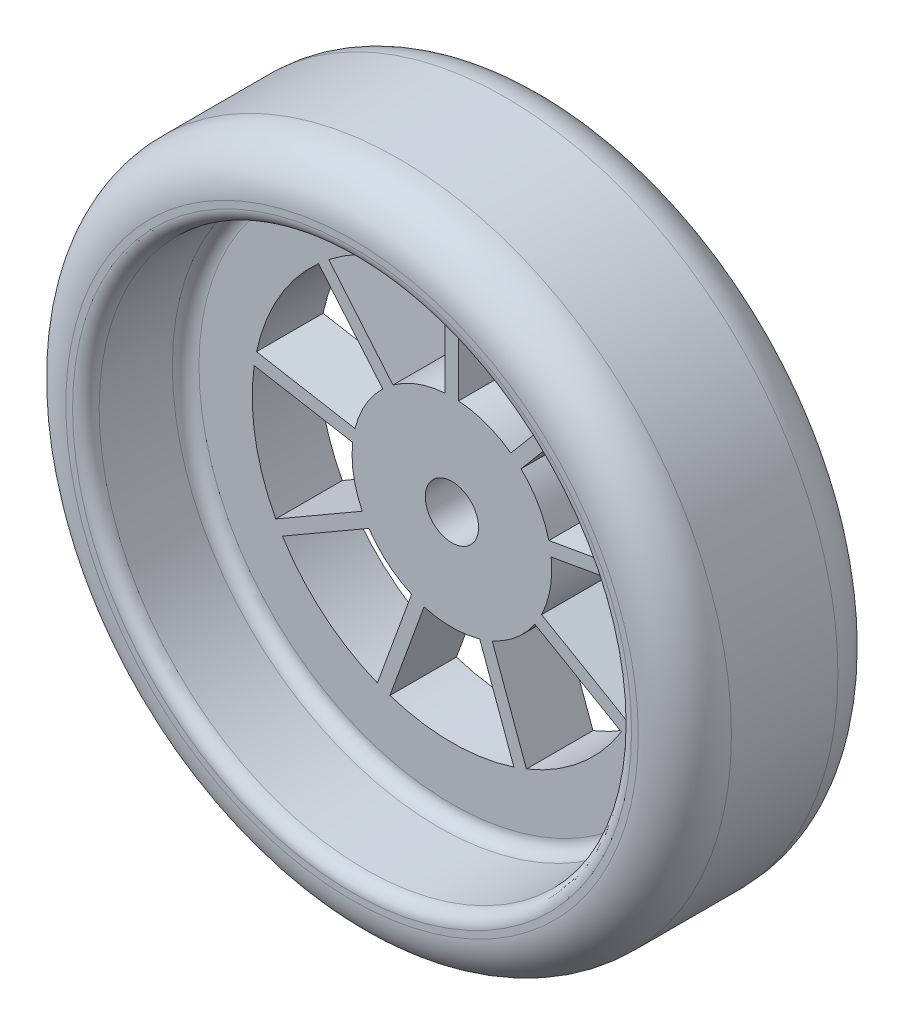
from build123d import *

# Parameters (mm, degrees)
SKETCH1_R           = 50
SKETCH1_R_2         = 40
BOSS_EXTRUDE1_DEPTH = 30
FILLET1_R           = 7
BOSS_EXTRUDE2_START = 5
BOSS_EXTRUDE2_DEPTH = 10
BOSS_EXTRUDE3_START = -10
SKETCH4_R           = 40
SKETCH4_R_2         = 30
BOSS_EXTRUDE3_DEPTH = 10
FILLET2_R           = 2
SKETCH5_R           = 4
CUT_EXTRUDE1_DEPTH  = 10


with BuildPart() as part:
    # Sketch1 → Boss-Extrude1 (new body)
    with BuildSketch(Plane.XY):
        Circle(SKETCH1_R)
        Circle(SKETCH1_R_2, mode=Mode.SUBTRACT)
    extrude(amount=BOSS_EXTRUDE1_DEPTH)

    # Fillet1
    fillet1_edges = [part.edges().sort_by_distance(p)[0] for p in [
        (-50, 0, 0),
        (-50, 0, 30),
    ]]
    fillet(fillet1_edges, radius=FILLET1_R)



with BuildPart() as body_2:
    # Sketch3 → Boss-Extrude2 (new body)
    with BuildSketch(Plane.XY.offset(BOSS_EXTRUDE2_START)):
        with BuildLine():
            Line((-1, 14.966629547), (-1, 29.983328701))
            ThreePointArc((-1, 29.983328701), (0, 30), (1, 29.983328701))
            Line((1, 29.983328701), (1, 14.966629547))
            ThreePointArc((1, 14.966629547), (3.09595155, 14.677025721), (5.13030215, 14.095389312))
            ThreePointArc((5.13030215, 14.095389312), (7.062573799, 13.233293291), (8.854319589, 12.107891006))
            Line((8.854319589, 12.107891006), (18.506867743, 23.611349947))
            ThreePointArc((18.506867743, 23.611349947), (19.283628291, 22.981333294), (20.038956629, 22.325774728))
            Line((20.038956629, 22.325774728), (10.386408475, 10.822315787))
            ThreePointArc((10.386408475, 10.822315787), (11.805846761, 9.253214698), (12.990381057, 7.5))
            ThreePointArc((12.990381057, 7.5), (13.916442376, 5.597555859), (14.565604637, 3.5837357))
            Line((14.565604637, 3.5837357), (29.354166388, 6.191358142))
            ThreePointArc((29.354166388, 6.191358142), (29.54423259, 5.20944533), (29.701462744, 4.221742636))
            Line((29.701462744, 4.221742636), (14.912900992, 1.614120194))
            ThreePointArc((14.912900992, 1.614120194), (14.991655066, -0.500278319), (14.772116295, -2.604722665))
            ThreePointArc((14.772116295, -2.604722665), (14.258652901, -4.657340169), (13.461481397, -6.61728937))
            Line((13.461481397, -6.61728937), (26.466324345, -14.125638947))
            ThreePointArc((26.466324345, -14.125638947), (25.980762114, -15), (25.466324345, -15.857689754))
            Line((25.466324345, -15.857689754), (12.461481397, -8.349340177))
            ThreePointArc((12.461481397, -8.349340177), (11.162701351, -10.019685551), (9.641814145, -11.490666647))
            ThreePointArc((9.641814145, -11.490666647), (7.929081266, -12.733014972), (6.058581404, -13.7220112))
            Line((6.058581404, -13.7220112), (11.194595001, -27.833092584))
            ThreePointArc((11.194595001, -27.833092584), (10.2606043, -28.190778624), (9.315209759, -28.51713287))
            Line((9.315209759, -28.51713287), (4.179196162, -14.406051487))
            ThreePointArc((4.179196162, -14.406051487), (2.110595615, -14.850770557), (0, -15))
            ThreePointArc((0, -15), (-2.110595615, -14.850770557), (-4.179196162, -14.406051487))
            Line((-4.179196162, -14.406051487), (-9.315209759, -28.51713287))
            ThreePointArc((-9.315209759, -28.51713287), (-10.2606043, -28.190778624), (-11.194595001, -27.833092584))
            Line((-11.194595001, -27.833092584), (-6.058581404, -13.7220112))
            ThreePointArc((-6.058581404, -13.7220112), (-7.929081266, -12.733014972), (-9.641814145, -11.490666647))
            ThreePointArc((-9.641814145, -11.490666647), (-11.162701351, -10.019685551), (-12.461481397, -8.349340177))
            Line((-12.461481397, -8.349340177), (-25.466324345, -15.857689754))
            ThreePointArc((-25.466324345, -15.857689754), (-25.980762114, -15), (-26.466324345, -14.125638947))
            Line((-26.466324345, -14.125638947), (-13.461481397, -6.61728937))
            ThreePointArc((-13.461481397, -6.61728937), (-14.258652901, -4.657340169), (-14.772116295, -2.604722665))
            ThreePointArc((-14.772116295, -2.604722665), (-14.991655066, -0.500278319), (-14.912900992, 1.614120194))
            Line((-14.912900992, 1.614120194), (-29.701462744, 4.221742636))
            ThreePointArc((-29.701462744, 4.221742636), (-29.54423259, 5.20944533), (-29.354166388, 6.191358142))
            Line((-29.354166388, 6.191358142), (-14.565604637, 3.5837357))
            ThreePointArc((-14.565604637, 3.5837357), (-13.916442376, 5.597555859), (-12.990381057, 7.5))
            ThreePointArc((-12.990381057, 7.5), (-11.805846761, 9.253214698), (-10.386408475, 10.822315787))
            Line((-10.386408475, 10.822315787), (-20.038956629, 22.325774728))
            ThreePointArc((-20.038956629, 22.325774728), (-19.283628291, 22.981333294), (-18.506867743, 23.611349947))
            Line((-18.506867743, 23.611349947), (-8.854319589, 12.107891006))
            ThreePointArc((-8.854319589, 12.107891006), (-7.062573799, 13.233293291), (-5.13030215, 14.095389312))
            ThreePointArc((-5.13030215, 14.095389312), (-3.09595155, 14.677025721), (-1, 14.966629547))
        make_face()
    extrude(amount=BOSS_EXTRUDE2_DEPTH)


with BuildPart() as part_1:
    add(part.part)

    add(body_2.part)  # Boss-Extrude3 merges body 2
    # Sketch4 → Boss-Extrude3 (add)
    with BuildSketch(Plane.XY.offset(15).offset(BOSS_EXTRUDE3_START)):
        Circle(SKETCH4_R)
        Circle(SKETCH4_R_2, mode=Mode.SUBTRACT)
    extrude(amount=BOSS_EXTRUDE3_DEPTH)

    # Fillet2
    fillet2_edges = [part_1.edges().sort_by_distance(p)[0] for p in [
        (-40, 0, 15),
        (-40, 0, 5),
        (-40, 0, 0),
        (-40, 0, 30),
    ]]
    fillet(fillet2_edges, radius=FILLET2_R)

    # Sketch5 → Cut-Extrude1 (cut)
    with BuildSketch(Plane.XY.offset(15)):
        Circle(SKETCH5_R)
    extrude(amount=-CUT_EXTRUDE1_DEPTH, mode=Mode.SUBTRACT)


solid = part_1.part
